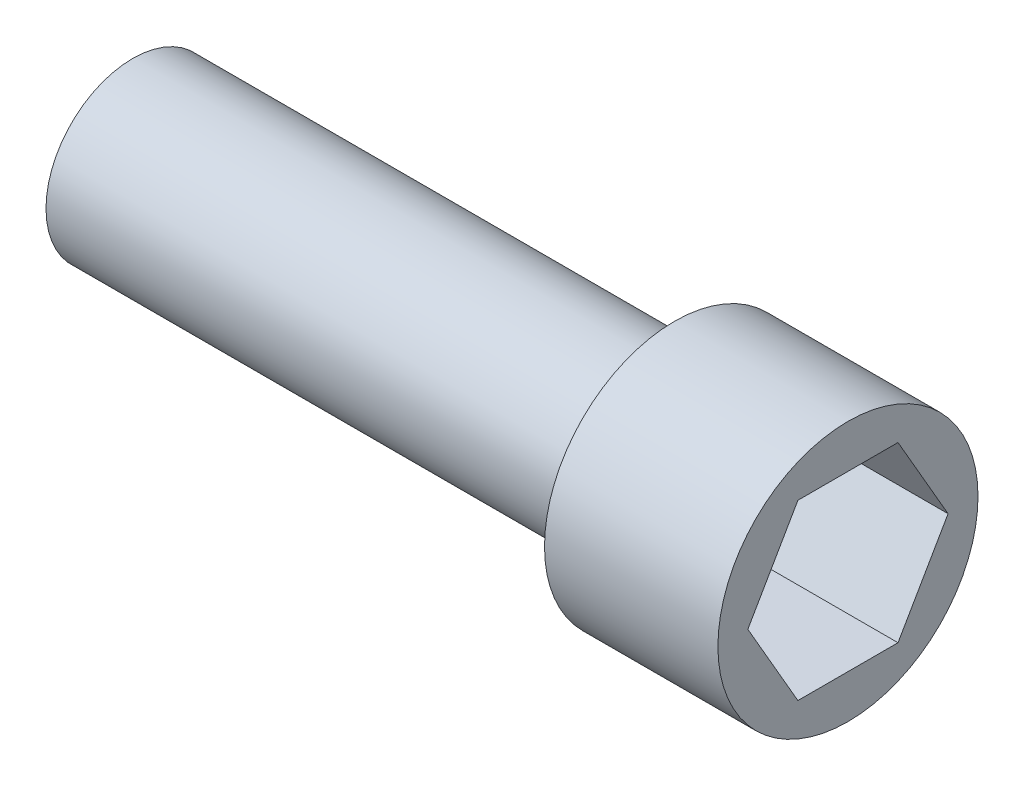
from build123d import *

# Parameters (mm, degrees)
CUT_EXTRUDE1_DEPTH = 6


with BuildPart() as part:
    # Sketch1 → Revolve1 (revolve)
    with BuildSketch(Plane.XY, mode=Mode.PRIVATE) as revolve1_sk:
        Polygon((0, 0), (0, 4), (25, 4), (25, 6), (33, 6), (33, 0), align=None)
    revolve(revolve1_sk.sketch.rotate(Axis((33, 0, 0), (-1, 0, 0)), 90), axis=Axis((33, 0, 0), (-1, 0, 0)))

    # Sketch2 → Cut-Extrude1 (cut)
    with BuildSketch(Plane(origin=(33, 0, 0), x_dir=(0, 0, -1), z_dir=(1, 0, 0))):
        Polygon((4.618802154, 0), (2.309401077, 4), (-2.309401077, 4), (-4.618802154, 0), (-2.309401077, -4), (2.309401077, -4), align=None)
    extrude(amount=-CUT_EXTRUDE1_DEPTH, mode=Mode.SUBTRACT)


solid = part.part
